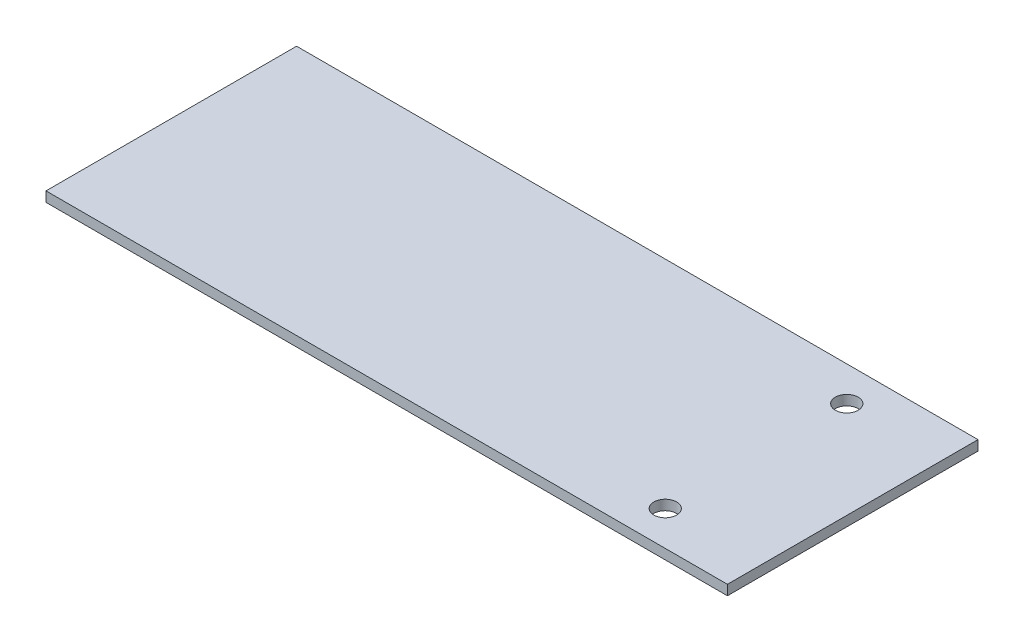
from build123d import *

# Parameters (mm, degrees)
SKETCH2_W           = 113.97
SKETCH2_H           = 41.91
BOSS_EXTRUDE1_DEPTH = 1.67
SKETCH3_R           = 1.9075
CUT_EXTRUDE1_DEPTH  = 61.73871212


with BuildPart() as part:
    # Sketch2 → Boss-Extrude1 (new body)
    with BuildSketch(Plane(origin=(0, 0, 0), x_dir=(1, 0, 0), z_dir=(0, 1, 0))):
        Rectangle(SKETCH2_W, SKETCH2_H)
    extrude(amount=BOSS_EXTRUDE1_DEPTH)

    # Sketch3 → Cut-Extrude1 (cut, through all)
    with BuildSketch(Plane(origin=(0, 1.67, 0), x_dir=(1, 0, 0), z_dir=(0, 1, 0))):
        with Locations(Location((40.8075, 15.18, 0), (0, 0, 270))):
            Circle(SKETCH3_R)
        with Locations(Location((40.8075, -15.18, 0), (0, 0, 270))):
            Circle(SKETCH3_R)
    extrude(amount=-CUT_EXTRUDE1_DEPTH, mode=Mode.SUBTRACT)


solid = part.part
